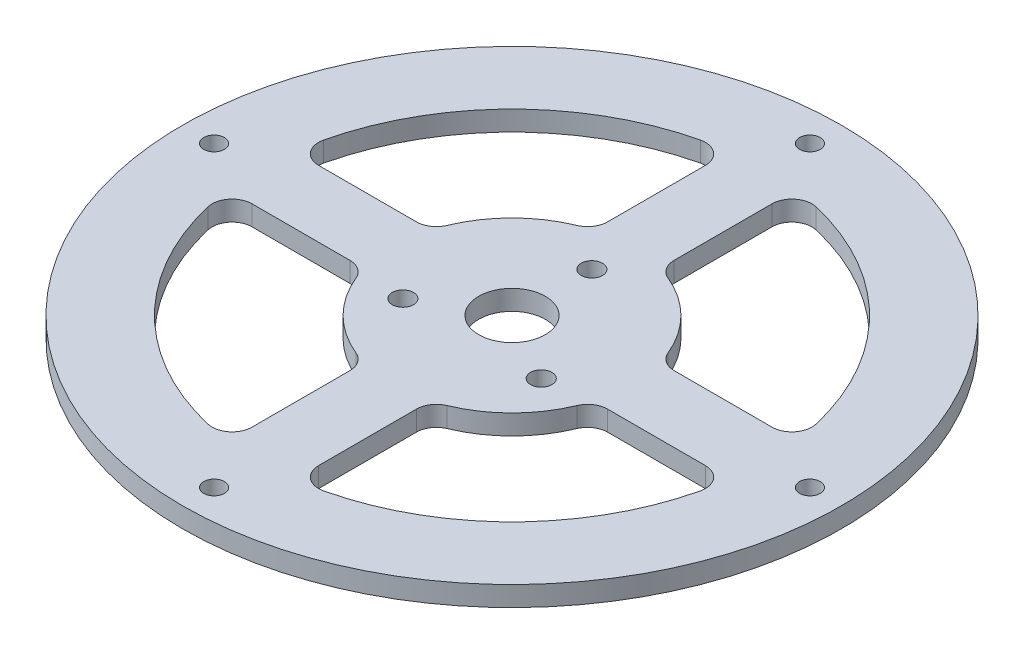
from build123d import *

# Parameters (mm, degrees)
SKETCH_1_R      = 49.5
SKETCH_1_R_2    = 1.55
SKETCH_1_R_3    = 5
SKETCH_1_R_4    = 1.6
EXTRUDE_1_DEPTH = 3


with BuildPart() as part:
    # 草图1 → 凸台-拉伸1 (new body)
    with BuildSketch(Plane(origin=(0, 0, 0), x_dir=(1, 0, 0), z_dir=(0, 1, 0))):
        with Locations(Location((0, 0, 0), (0, 0, 270))):
            Circle(SKETCH_1_R)
        with Locations(Location((0, 44.75, 0), (0, 0, 270))):
            Circle(SKETCH_1_R_2, mode=Mode.SUBTRACT)
        with Locations(Location((-44.75, 0, 0), (0, 0, 270))):
            Circle(SKETCH_1_R_2, mode=Mode.SUBTRACT)
        with Locations(Location((0, -44.75, 0), (0, 0, 90))):
            Circle(SKETCH_1_R_2, mode=Mode.SUBTRACT)
        with Locations(Location((44.75, 0, 0), (0, 0, 90))):
            Circle(SKETCH_1_R_2, mode=Mode.SUBTRACT)
        with Locations(Location((0, 0, 0), (0, 0, 270))):
            Circle(SKETCH_1_R_3, mode=Mode.SUBTRACT)
        with Locations(Location((0, 12, 0), (0, 0, 270))):
            Circle(SKETCH_1_R_4, mode=Mode.SUBTRACT)
        with Locations(Location((10.392304845, -6, 0), (0, 0, 270))):
            Circle(SKETCH_1_R_4, mode=Mode.SUBTRACT)
        with Locations(Location((-10.392304845, -6, 0), (0, 0, 270))):
            Circle(SKETCH_1_R_4, mode=Mode.SUBTRACT)
        with BuildLine():
            Line((-34.045948677, 5), (-19.355269263, 5))
            ThreePointArc((-19.355269263, 5), (-17.687611546, 5.506224201), (-16.582759625, 6.854054841))
            ThreePointArc((-16.582759625, 6.854054841), (-12.687907325, 12.687907325), (-6.854054841, 16.582759625))
            ThreePointArc((-6.854054841, 16.582759625), (-5.506224201, 17.687611546), (-5, 19.355269263))
            Line((-5, 19.355269263), (-5, 34.045948677))
            ThreePointArc((-5, 34.045948677), (-6.137034306, 36.397407548), (-8.686239215, 36.966406815))
            ThreePointArc((-8.686239215, 36.966406815), (-26.851126462, 26.851126462), (-36.966406815, 8.686239215))
            ThreePointArc((-36.966406815, 8.686239215), (-36.397407548, 6.137034306), (-34.045948677, 5))
        make_face(mode=Mode.SUBTRACT)
        with BuildLine():
            Line((34.045948677, 5), (19.355269263, 5))
            ThreePointArc((19.355269263, 5), (17.687611546, 5.506224201), (16.582759625, 6.854054841))
            ThreePointArc((16.582759625, 6.854054841), (12.687907325, 12.687907325), (6.854054841, 16.582759625))
            ThreePointArc((6.854054841, 16.582759625), (5.506224201, 17.687611546), (5, 19.355269263))
            Line((5, 19.355269263), (5, 34.045948677))
            ThreePointArc((5, 34.045948677), (6.137034306, 36.397407548), (8.686239215, 36.966406815))
            ThreePointArc((8.686239215, 36.966406815), (26.851126462, 26.851126462), (36.966406815, 8.686239215))
            ThreePointArc((36.966406815, 8.686239215), (36.397407548, 6.137034306), (34.045948677, 5))
        make_face(mode=Mode.SUBTRACT)
        with BuildLine():
            Line((34.045948677, -5), (19.355269263, -5))
            ThreePointArc((19.355269263, -5), (17.687611546, -5.506224201), (16.582759625, -6.854054841))
            ThreePointArc((16.582759625, -6.854054841), (12.687907325, -12.687907325), (6.854054841, -16.582759625))
            ThreePointArc((6.854054841, -16.582759625), (5.506224201, -17.687611546), (5, -19.355269263))
            Line((5, -19.355269263), (5, -34.045948677))
            ThreePointArc((5, -34.045948677), (6.137034306, -36.397407548), (8.686239215, -36.966406815))
            ThreePointArc((8.686239215, -36.966406815), (26.851126462, -26.851126462), (36.966406815, -8.686239215))
            ThreePointArc((36.966406815, -8.686239215), (36.397407548, -6.137034306), (34.045948677, -5))
        make_face(mode=Mode.SUBTRACT)
        with BuildLine():
            Line((-34.045948677, -5), (-19.355269263, -5))
            ThreePointArc((-19.355269263, -5), (-17.687611546, -5.506224201), (-16.582759625, -6.854054841))
            ThreePointArc((-16.582759625, -6.854054841), (-12.687907325, -12.687907325), (-6.854054841, -16.582759625))
            ThreePointArc((-6.854054841, -16.582759625), (-5.506224201, -17.687611546), (-5, -19.355269263))
            Line((-5, -19.355269263), (-5, -34.045948677))
            ThreePointArc((-5, -34.045948677), (-6.137034306, -36.397407548), (-8.686239215, -36.966406815))
            ThreePointArc((-8.686239215, -36.966406815), (-26.851126462, -26.851126462), (-36.966406815, -8.686239215))
            ThreePointArc((-36.966406815, -8.686239215), (-36.397407548, -6.137034306), (-34.045948677, -5))
        make_face(mode=Mode.SUBTRACT)
    extrude(amount=EXTRUDE_1_DEPTH)


solid = part.part
